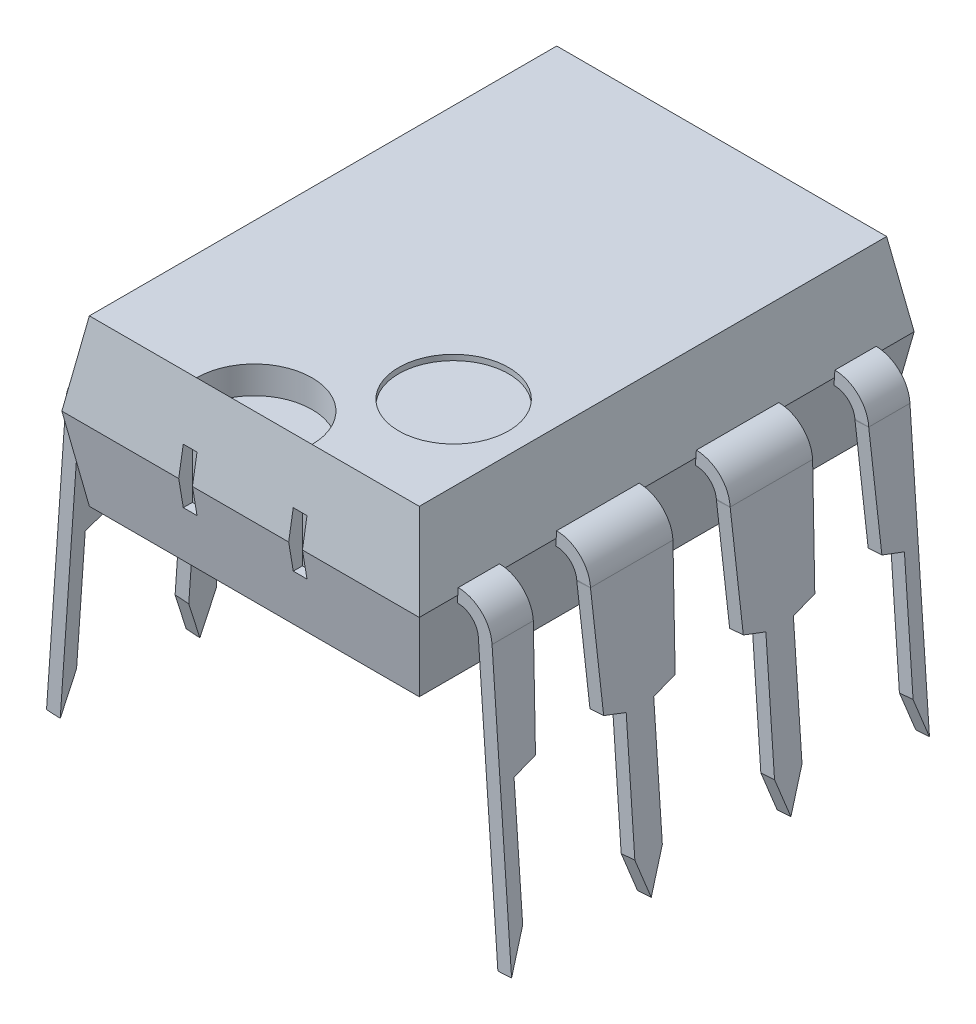
from build123d import *

# Parameters (mm, degrees)
CUT_EXTRUDE3_DEPTH = 0.5
SKETCH7_3_R        = 1
CUT_EXTRUDE4_DEPTH = 0.1
SKETCH3_W          = 0.25
SKETCH3_H          = 1
CUT_EXTRUDE1_DEPTH = 0.25
SKETCH5_W          = 0.25
SKETCH5_H          = 1.5
CUT_EXTRUDE2_DEPTH = 0.249391013
LPATTERN1_COUNT    = 3
LPATTERN1_PITCH    = 2.54
CUT_EXTRUDE5_REACH = 13.775
SKETCH8_W          = 0.813078276
SKETCH8_H          = 5.718154448
SKETCH9_W          = 0.25
SKETCH9_H          = 1
CUT_EXTRUDE6_DEPTH = 0.25


with BuildPart() as part:
    # Sketch1 → Loft1 section 0
    with BuildSketch(Plane(origin=(0, 0, 0), x_dir=(1, 0, 0), z_dir=(0, 1, 0))):
        with BuildLine():
            Line((-3, 4.25), (3, 4.25))
            Line((3, 4.25), (3, -4.25))
            Line((3, -4.25), (-3, -4.25))
            Line((-3, -4.25), (-3, 4.25))
        make_face()
    # Sketch2 → Loft1 section 1
    with BuildSketch(Plane(origin=(0, -1.5, 0), x_dir=(1, 0, 0), z_dir=(0, 1, 0))):
        with BuildLine():
            Line((3.25, -4.5), (-3.25, -4.5))
            Line((-3.25, -4.5), (-3.25, 4.5))
            Line((-3.25, 4.5), (3.25, 4.5))
            Line((3.25, 4.5), (3.25, -4.5))
        make_face()
    loft1 = loft()


with BuildPart() as mirror1_1:
    # Mirror1: Loft1 across Plane1
    add(loft1.mirror(Plane(origin=(0, -1.5, 0), x_dir=(1, 0, 0), z_dir=(0, 1, 0))))


with BuildPart() as part_1:
    add(part.part)

    # Mirror1 united with what the copies touc: union Mirror1_1
    add(mirror1_1.part)

    # Sketch7 → Cut-Extrude3 (cut)
    with BuildSketch(Plane(origin=(0, 0, 0), x_dir=(1, 0, 0), z_dir=(0, 1, 0))):
        with BuildLine():
            Line((-1.05, -4.25), (1.05, -4.25))
            ThreePointArc((1.05, -4.25), (0, -3.2), (-1.05, -4.25))
        make_face()
    extrude(amount=-CUT_EXTRUDE3_DEPTH, mode=Mode.SUBTRACT)

    # Sketch7<3> → Cut-Extrude4 (cut)
    with BuildSketch(Plane(origin=(0, 0, 0), x_dir=(1, 0, 0), z_dir=(0, 1, 0))):
        with Locations(Location((1.625, -2.25, 0), (0, 0, 270))):
            Circle(SKETCH7_3_R)
    extrude(amount=-CUT_EXTRUDE4_DEPTH, mode=Mode.SUBTRACT)

    # Sketch3 → Cut-Extrude1 (cut)
    with BuildSketch(Plane.XY.offset(4.5)):
        with Locations((-1, -1.5)):
            Rectangle(SKETCH3_W, SKETCH3_H)
        with Locations((1, -1.5)):
            Rectangle(SKETCH3_W, SKETCH3_H)
    extrude(amount=-CUT_EXTRUDE1_DEPTH, mode=Mode.SUBTRACT)

    # Sketch9 → Cut-Extrude6 (cut)
    with BuildSketch(Plane.XY.offset(-4.5)):
        with Locations((-0.003175804, -1.525987699)):
            Rectangle(SKETCH9_W, SKETCH9_H)
    extrude(amount=CUT_EXTRUDE6_DEPTH, mode=Mode.SUBTRACT)


with BuildPart() as body_2:
    # Sweep1: sweep along a path in Sketch4
    with BuildLine(Plane.XY.offset(3.8)) as sweep1_path:
        Line((4.104540041, -7.052698419), (3.748782025, -1.965121763))
        ThreePointArc((3.748782025, -1.965121763), (3.59099918, -1.634323149), (3.25, -1.5))
    # Sketch5 → Sweep1 (sweep)
    with BuildSketch(Plane(origin=(0, -7.052698419, 0), x_dir=(1, 0, 0), z_dir=(0, 1, 0))):
        with Locations((4.104540041, -3.8)):
            Rectangle(SKETCH5_W, SKETCH5_H)
    sweep(path=sweep1_path.line)

    # Sketch6 → Cut-Extrude2 (cut)
    with BuildSketch(Plane(origin=(3.71818629, 0.260000913, 0), x_dir=(0, 0, -1), z_dir=(0.9975640502598243, 0.06975647374412597, 0))):
        Polygon((-3.15, -4.230556199), (-3.55, -4.376144293), (-3.55, -6.630556199), (-3.8, -7.317425554), (-4.05, -6.630556199), (-4.05, -4.376144293), (-4.45, -4.230556199), (-4.55, -2.230556199), (-4.55, -3.830556199), (-4.55, -7.330556199), (-3.05, -7.330556199), (-3.05, -3.830556199), (-3.05, -2.230556199), align=None)
    extrude(amount=-CUT_EXTRUDE2_DEPTH, mode=Mode.SUBTRACT)


with BuildPart() as lpattern1_1:
    # LPattern1: pattern copy
    add(body_2.part.moved(Location(Vector(0, 0, -1) * (1 * LPATTERN1_PITCH))))


with BuildPart() as lpattern1_2:
    # LPattern1: pattern copy
    add(body_2.part.moved(Location(Vector(0, 0, -1) * (2 * LPATTERN1_PITCH))))


with BuildPart() as body_2_1:
    add(body_2.part)

    # Cut-Extrude5: up to this plane
    cut_extrude5_end = Plane(origin=(2.96368176, -5.594541588, 0), z_dir=(0.9975640502598243, -0.06975647374412595, 0))
    # Sketch8 → Cut-Extrude5 (cut, up to the surface)
    with BuildSketch(Plane(origin=(4.71575034, 0.329757387, 0), x_dir=(0, 0, -1), z_dir=(0.9975640502598243, 0.06975647374412597, 0)), mode=Mode.PRIVATE) as cut_extrude5_sk1:
        with Locations((-4.206539138, -4.45834833)):
            Rectangle(SKETCH8_W, SKETCH8_H)
    cut_extrude5_tool1 = split(extrude(cut_extrude5_sk1.sketch, amount=-CUT_EXTRUDE5_REACH, mode=Mode.PRIVATE), bisect_by=cut_extrude5_end, keep=Keep.BOTH, mode=Mode.PRIVATE)
    add(cut_extrude5_tool1.solids().sort_by_distance((5.026749, -4.117731, 4.206539))[0], mode=Mode.SUBTRACT)


with BuildPart() as body_5:
    # Mirror4: mirrored copy
    add(body_2_1.part.mirror(Plane.XY))


with BuildPart() as body_6:
    # Mirror5: mirrored copy
    add(lpattern1_1.part.mirror(Plane(origin=(0, 0, 0), x_dir=(0, 0, 1), z_dir=(1, 0, 0))))


with BuildPart() as body_7:
    # Mirror5 2: mirrored copy
    add(lpattern1_2.part.mirror(Plane(origin=(0, 0, 0), x_dir=(0, 0, 1), z_dir=(1, 0, 0))))


with BuildPart() as body_8:
    # Mirror5 3: mirrored copy
    add(body_5.part.mirror(Plane(origin=(0, 0, 0), x_dir=(0, 0, 1), z_dir=(1, 0, 0))))


with BuildPart() as body_9:
    # Mirror5 4: mirrored copy
    add(body_2_1.part.mirror(Plane(origin=(0, 0, 0), x_dir=(0, 0, 1), z_dir=(1, 0, 0))))


solid = Compound([part_1.part, lpattern1_1.part, lpattern1_2.part, body_2_1.part, body_5.part, body_6.part, body_7.part, body_8.part, body_9.part])
